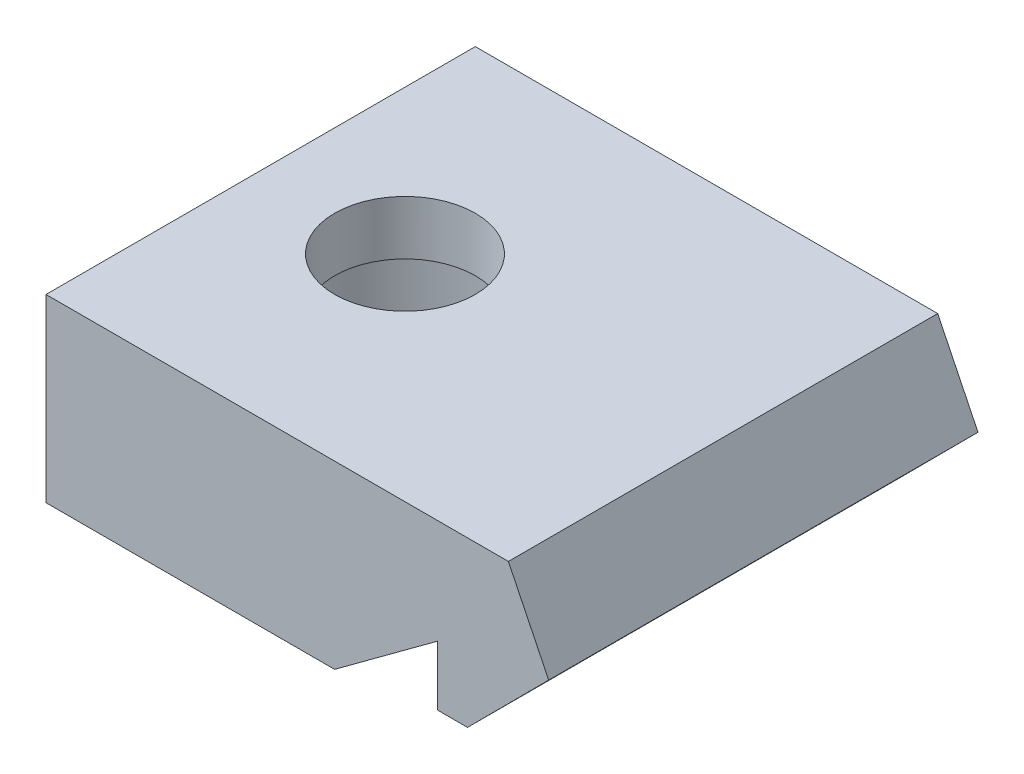
from build123d import *

# Parameters (mm, degrees)
EXTRUDE_1_DEPTH     = 5.95
CUT_EXTRUDE_1_REACH = 17.955
SKETCH_2_R          = 1.95
SKETCH_3_R          = 3.5
CUT_EXTRUDE_2_DEPTH = 3.5


with BuildPart() as part:
    # 스케치1 → 보스-돌출1 (new, symmetric)
    with BuildSketch(Plane.XY):
        Polygon((12.816760605, 0), (0, 0), (0, -5), (8, -5), (10.849275014, -2.899040406), (10.849275014, -4.551199566), (11.683700245, -4.551199566), (13.93379398, -2.290921493), align=None)
    extrude(amount=EXTRUDE_1_DEPTH, both=True)

    # 스케치2 → 컷-돌출1 (cut, up to next)
    with BuildSketch(Plane.XZ.offset(5), mode=Mode.PRIVATE) as cut_extrude_1_sk1:
        with Locations(Location((4, 0, 0), (0, 0, 270))):
            Circle(SKETCH_2_R)
    cut_extrude_1_tool1 = extrude(cut_extrude_1_sk1.sketch, amount=-CUT_EXTRUDE_1_REACH, mode=Mode.PRIVATE) & part.part
    add(cut_extrude_1_tool1.solids().sort_by_distance((4, -5, 0))[0], mode=Mode.SUBTRACT)

    # 스케치3 → 컷-돌출2 (cut)
    with BuildSketch(Plane.XZ.offset(5)):
        with Locations(Location((4, 0, 0), (0, 0, 270))):
            Circle(SKETCH_3_R)
    extrude(amount=-CUT_EXTRUDE_2_DEPTH, mode=Mode.SUBTRACT)


solid = part.part
